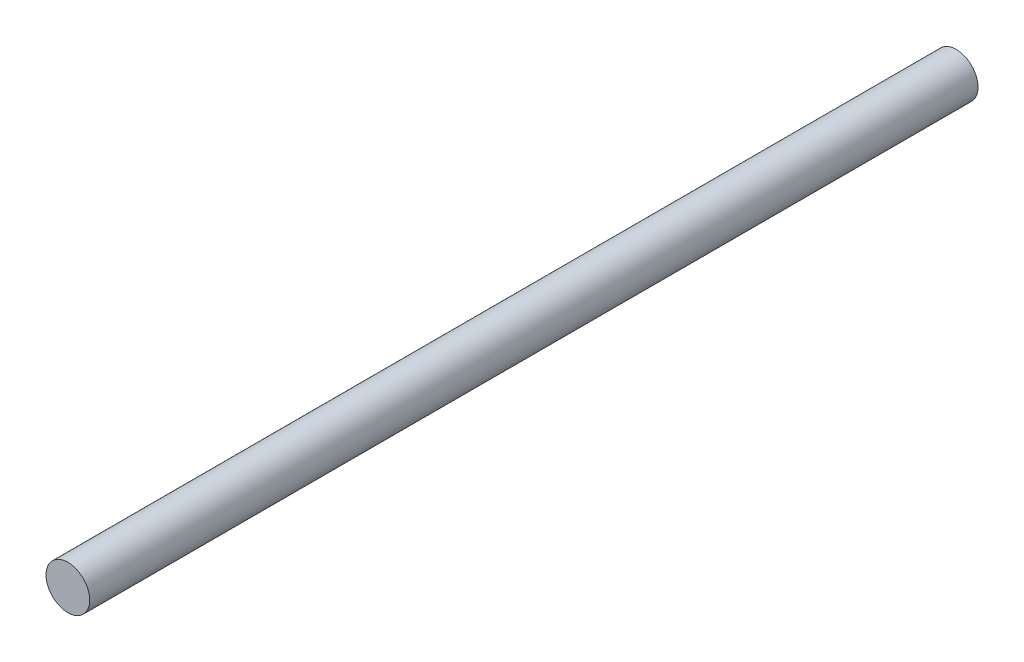
from build123d import *

# Parameters (mm, degrees)
SKETCH1_R           = 1.5
BOSS_EXTRUDE1_DEPTH = 61


with BuildPart() as part:
    # Sketch1 → Boss-Extrude1 (new body)
    with BuildSketch(Plane.XY):
        with Locations(Location((0, 0, 0), (0, 0, 180))):
            Circle(SKETCH1_R)
    extrude(amount=BOSS_EXTRUDE1_DEPTH)


solid = part.part
